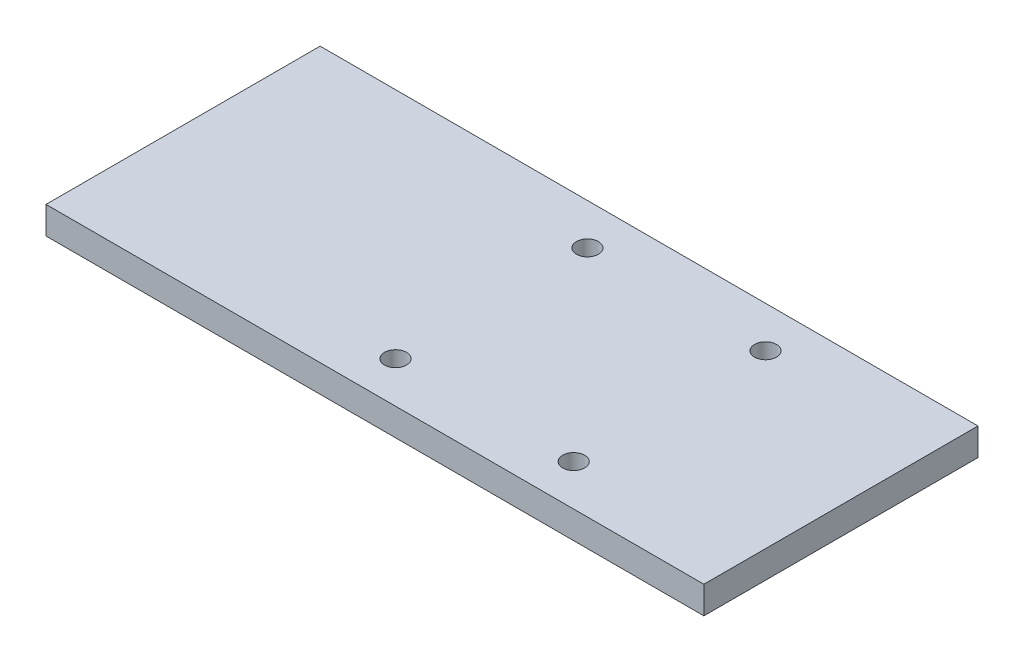
from build123d import *

# Parameters (mm, degrees)
SKETCH1_W                  = 63.5
SKETCH1_H                  = 6.35
BOSS_EXTRUDE1_DEPTH        = 76.2
F_10_CLEARANCE_HOLE1_D     = 5.1054
F_10_CLEARANCE_HOLE1_DEPTH = 9.652
F_10_CLEARANCE_HOLE1_TIP   = 1.533816902


with BuildPart() as part:
    # Sketch1 → Boss-Extrude1 (new, symmetric)
    with BuildSketch(Plane(origin=(0, 0, 0), x_dir=(0, 0, -1), z_dir=(1, 0, 0))):
        Rectangle(SKETCH1_W, SKETCH1_H)
    extrude(amount=BOSS_EXTRUDE1_DEPTH, both=True)

    # #10 Clearance Hole1
    with Locations(Plane(origin=(0, 3.175, 0), x_dir=(1, 0, 0), z_dir=(0, 1, 0))):
        with Locations((-4.7625, 22.225), (36.5125, -22.225), (-4.7625, -22.225), (36.5125, 22.225)):
            Hole(F_10_CLEARANCE_HOLE1_D / 2, depth=F_10_CLEARANCE_HOLE1_DEPTH)
            with Locations((0, 0, -(F_10_CLEARANCE_HOLE1_DEPTH + F_10_CLEARANCE_HOLE1_TIP / 2))):  # 118° drill point
                Cone(0, F_10_CLEARANCE_HOLE1_D / 2, F_10_CLEARANCE_HOLE1_TIP, mode=Mode.SUBTRACT)


solid = part.part
